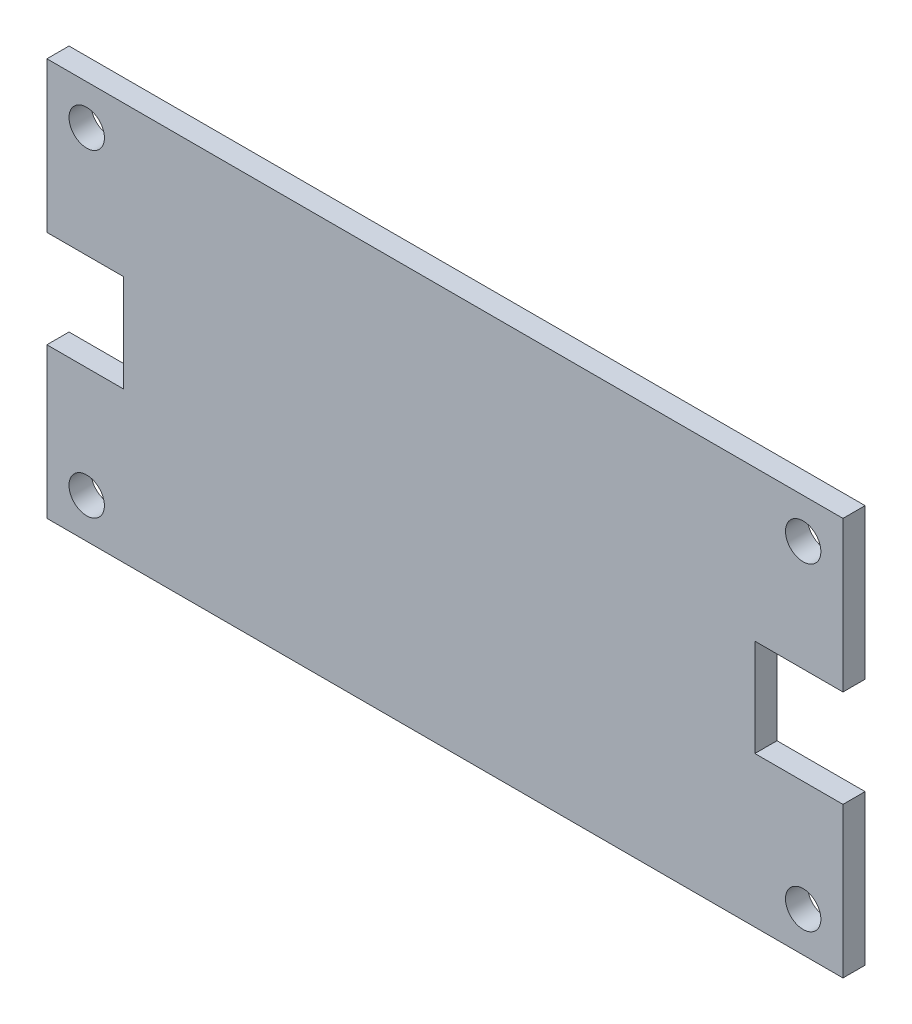
from build123d import *

# Parameters (mm, degrees)
SKETCH1_W           = 180
SKETCH1_H           = 90
BOSS_EXTRUDE1_DEPTH = 5
SKETCH5_W           = 15.917599426
SKETCH5_H           = 22
SKETCH5_W_2         = 13.264666189
CUT_EXTRUDE3_DEPTH  = 101.747208398
SKETCH7_W           = 4
SKETCH7_H           = 22
CUT_EXTRUDE13_DEPTH = 101.747208398
SKETCH8_R           = 4
CUT_EXTRUDE14_DEPTH = 101.747208398
SKETCH9_W           = 45
SKETCH9_H           = 80
CUT_EXTRUDE15_DEPTH = 3
SKETCH10_W          = 46
SKETCH10_H          = 48
CUT_EXTRUDE16_DEPTH = 3


with BuildPart() as part:
    # Sketch1 → Boss-Extrude1 (new body)
    with BuildSketch(Plane.XY):
        Rectangle(SKETCH1_W, SKETCH1_H)
    extrude(amount=BOSS_EXTRUDE1_DEPTH)

    # Sketch5 → Cut-Extrude3 (cut, through all)
    with BuildSketch(Plane(origin=(0, 0, 0), x_dir=(-1, 0, 0), z_dir=(0, 0, -1))):
        with Locations((-82.041200287, 0)):
            Rectangle(SKETCH5_W, SKETCH5_H)
        with Locations((83.367666906, 0)):
            Rectangle(SKETCH5_W_2, SKETCH5_H)
    extrude(amount=-CUT_EXTRUDE3_DEPTH, mode=Mode.SUBTRACT)

    # Sketch7 → Cut-Extrude13 (cut, through all)
    with BuildSketch(Plane(origin=(0, 0, 0), x_dir=(-1, 0, 0), z_dir=(0, 0, -1))):
        with Locations((-72.082400574, 0)):
            Rectangle(SKETCH7_W, SKETCH7_H)
        with Locations((74.735333811, 0)):
            Rectangle(SKETCH7_W, SKETCH7_H)
    extrude(amount=-CUT_EXTRUDE13_DEPTH, mode=Mode.SUBTRACT)

    # Sketch8 → Cut-Extrude14 (cut, through all)
    with BuildSketch(Plane(origin=(0, 0, 0), x_dir=(-1, 0, 0), z_dir=(0, 0, -1))):
        with Locations((-81, 36)):
            Circle(SKETCH8_R)
        with Locations(Location((81, 36, 0), (0, 0, 180))):
            Circle(SKETCH8_R)
        with Locations((81, -36)):
            Circle(SKETCH8_R)
        with Locations(Location((-81, -36, 0), (0, 0, 180))):
            Circle(SKETCH8_R)
    extrude(amount=-CUT_EXTRUDE14_DEPTH, mode=Mode.SUBTRACT)

    # Sketch9 → Cut-Extrude15 (cut)
    with BuildSketch(Plane(origin=(0, 0, 0), x_dir=(-1, 0, 0), z_dir=(0, 0, -1))):
        with Locations((-27.5, 0)):
            Rectangle(SKETCH9_W, SKETCH9_H)
    extrude(amount=-CUT_EXTRUDE15_DEPTH, mode=Mode.SUBTRACT)

    # Sketch10 → Cut-Extrude16 (cut)
    with BuildSketch(Plane(origin=(0, 0, 0), x_dir=(-1, 0, 0), z_dir=(0, 0, -1))):
        with Locations((28, 0)):
            Rectangle(SKETCH10_W, SKETCH10_H)
    extrude(amount=-CUT_EXTRUDE16_DEPTH, mode=Mode.SUBTRACT)


solid = part.part
